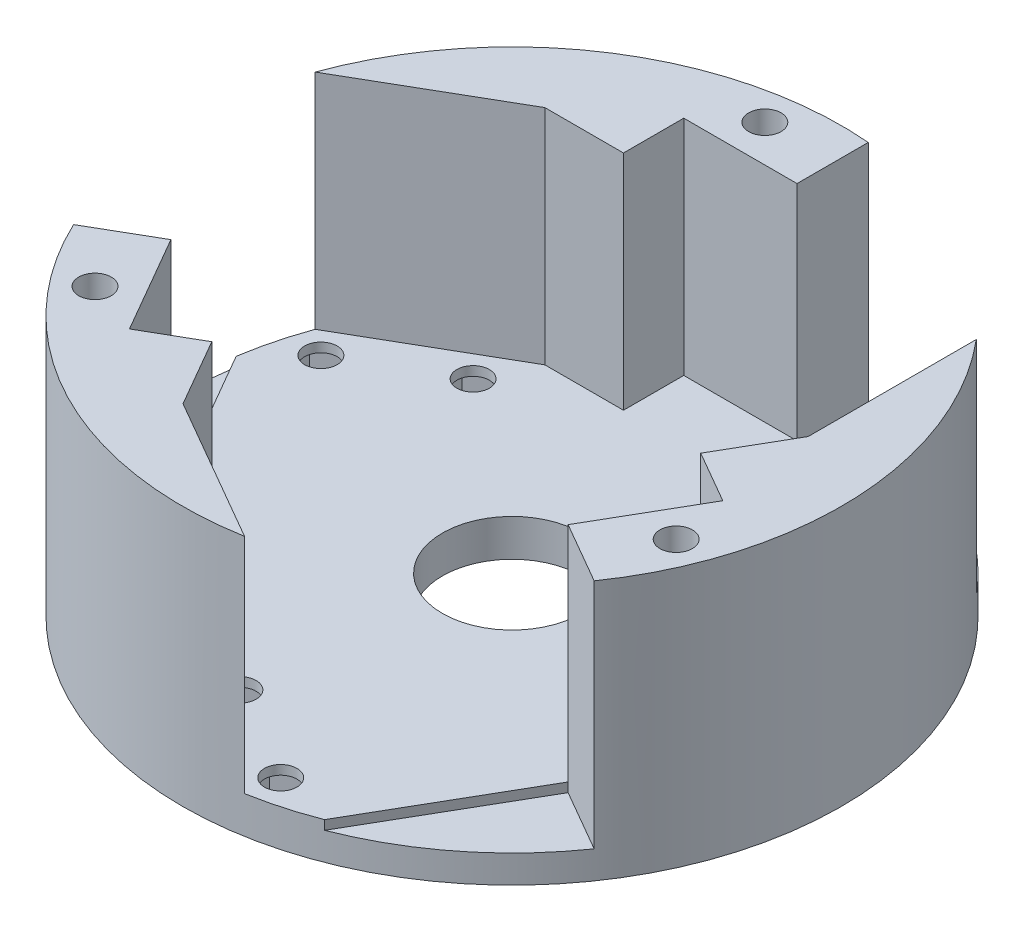
from build123d import *

# Parameters (mm, degrees)
SKETCH1_R           = 35.5
BOSS_EXTRUDE1_DEPTH = 14
CUT_EXTRUDE1_DEPTH  = 24
SKETCH3_W           = 20
SKETCH3_H           = 10
CUT_EXTRUDE2_DEPTH  = 25
SKETCH4_R           = 1.75
CUT_EXTRUDE3_DEPTH  = 58.484780595
CUT_EXTRUDE4_DEPTH  = 3
SKETCH6_R           = 1.75
CUT_EXTRUDE5_DEPTH  = 58.484780595
CUT_EXTRUDE6_DEPTH  = 3
SKETCH8_R           = 7.5
CUT_EXTRUDE7_DEPTH  = 56.646203824


with BuildPart() as part:
    # Sketch1 → Boss-Extrude1 (new, symmetric)
    with BuildSketch(Plane(origin=(0, 0, 0), x_dir=(1, 0, 0), z_dir=(0, 1, 0))):
        with Locations(Location((0, 0, 0), (0, 0, 270))):
            Circle(SKETCH1_R)
    extrude(amount=BOSS_EXTRUDE1_DEPTH, both=True)

    # Sketch2 → Cut-Extrude1 (cut)
    with BuildSketch(Plane(origin=(0, 14, 0), x_dir=(1, 0, 0), z_dir=(0, 1, 0))):
        Polygon((27.2, 27.7), (27.2, 4.7), (22.964840301, -2.635511777), (28.588903685, -5.882566285), (10.388903685, -37.405890983), (-9.529680602, -25.905890983), (-13.764840301, -18.570379206), (-19.388903685, -21.817433715), (-37.588903685, 9.705890983), (-17.670319398, 21.205890983), (-9.2, 21.205890983), (-9.2, 27.7), align=None)
    extrude(amount=-CUT_EXTRUDE1_DEPTH, mode=Mode.SUBTRACT)

    # Sketch3 → Cut-Extrude2 (cut)
    with BuildSketch(Plane(origin=(0, 14, 0), x_dir=(1, 0, 0), z_dir=(0, 1, 0))):
        Polygon((-35.488903685, 6.068584287), (-44.149157723, 1.068584287), (-34.149157723, -16.251923789), (-25.488903685, -11.251923789), align=None)
        with Locations((13, 32.7)):
            Rectangle(SKETCH3_W, SKETCH3_H)
        Polygon((12.488903685, -33.768584287), (21.149157723, -38.768584287), (31.149157723, -21.448076211), (22.488903685, -16.448076211), align=None)
    extrude(amount=-CUT_EXTRUDE2_DEPTH, mode=Mode.SUBTRACT)

    # Sketch4 → Cut-Extrude3 (cut, through all)
    with BuildSketch(Plane(origin=(0, 14, 0), x_dir=(1, 0, 0), z_dir=(0, 1, 0))):
        with Locations(Location((-4.453539231, 31.6885782, 0), (0, 0, 270))):
            Circle(SKETCH4_R)
        with Locations(Location((29.669883346, -11.987410989, 0), (0, 0, 270))):
            Circle(SKETCH4_R)
        with Locations(Location((-25.216344115, -19.70116721, 0), (0, 0, 270))):
            Circle(SKETCH4_R)
    extrude(amount=-CUT_EXTRUDE3_DEPTH, mode=Mode.SUBTRACT)

    # Sketch5 → Cut-Extrude4 (cut)
    with BuildSketch(Plane.XZ.offset(14)):
        Polygon((-26.861792383, 22.55116721), (-28.50724065, 19.70116721), (-26.861792383, 16.85116721), (-23.570895848, 16.85116721), (-21.925447581, 19.70116721), (-23.570895848, 22.55116721), align=None)
        Polygon((32.960779881, 11.987410989), (31.315331613, 14.837410989), (28.024435079, 14.837410989), (26.378986812, 11.987410989), (28.024435079, 9.137410989), (31.315331613, 9.137410989), align=None)
        Polygon((-6.098987498, -34.5385782), (-2.808090964, -34.5385782), (-1.162642696, -31.6885782), (-2.808090964, -28.8385782), (-6.098987498, -28.8385782), (-7.744435765, -31.6885782), align=None)
    extrude(amount=-CUT_EXTRUDE4_DEPTH, mode=Mode.SUBTRACT)

    # Sketch6 → Cut-Extrude5 (cut, through all)
    with BuildSketch(Plane.XZ.offset(14)):
        with Locations(Location((6.619546181, 31.534609691, 0), (0, 0, 270))):
            Circle(SKETCH6_R)
        with Locations(Location((-3.772758664, 25.534609691, 0), (0, 0, 270))):
            Circle(SKETCH6_R)
        with Locations(Location((24, -21.5, 0), (0, 0, 270))):
            Circle(SKETCH6_R)
        with Locations(Location((24, -9.5, 0), (0, 0, 270))):
            Circle(SKETCH6_R)
        with Locations(Location((-30.619546181, -10.034609691, 0), (0, 0, 270))):
            Circle(SKETCH6_R)
        with Locations(Location((-20.227241336, -16.034609691, 0), (0, 0, 270))):
            Circle(SKETCH6_R)
    extrude(amount=-CUT_EXTRUDE5_DEPTH, mode=Mode.SUBTRACT)

    # Sketch7 → Cut-Extrude6 (cut)
    with BuildSketch(Plane.XZ.offset(14)):
        Polygon((9.469546181, 29.889161424), (9.469546181, 33.180057958), (6.619546181, 34.825506225), (3.769546181, 33.180057958), (3.769546181, 29.889161424), (6.619546181, 28.243713156), align=None)
        Polygon((-30.619546181, -6.743713156), (-33.469546181, -8.389161424), (-33.469546181, -11.680057958), (-30.619546181, -13.325506225), (-27.769546181, -11.680057958), (-27.769546181, -8.389161424), align=None)
        Polygon((-23.077241336, -14.389161424), (-23.077241336, -17.680057958), (-20.227241336, -19.325506225), (-17.377241336, -17.680057958), (-17.377241336, -14.389161424), (-20.227241336, -12.743713156), align=None)
        Polygon((-0.922758664, 27.180057958), (-3.772758664, 28.825506225), (-6.622758664, 27.180057958), (-6.622758664, 23.889161424), (-3.772758664, 22.243713156), (-0.922758664, 23.889161424), align=None)
        Polygon((21.15, -23.145448267), (24, -24.790896534), (26.85, -23.145448267), (26.85, -19.854551733), (24, -18.209103466), (21.15, -19.854551733), align=None)
        Polygon((24, -12.790896534), (26.85, -11.145448267), (26.85, -7.854551733), (24, -6.209103466), (21.15, -7.854551733), (21.15, -11.145448267), align=None)
    extrude(amount=-CUT_EXTRUDE6_DEPTH, mode=Mode.SUBTRACT)

    # Sketch8 → Cut-Extrude7 (cut, through all)
    with BuildSketch(Plane(origin=(0, -10, 0), x_dir=(1, 0, 0), z_dir=(0, 1, 0))):
        with Locations(Location((0, 0, 0), (0, 0, 270))):
            Circle(SKETCH8_R)
    extrude(amount=-CUT_EXTRUDE7_DEPTH, mode=Mode.SUBTRACT)


solid = part.part
